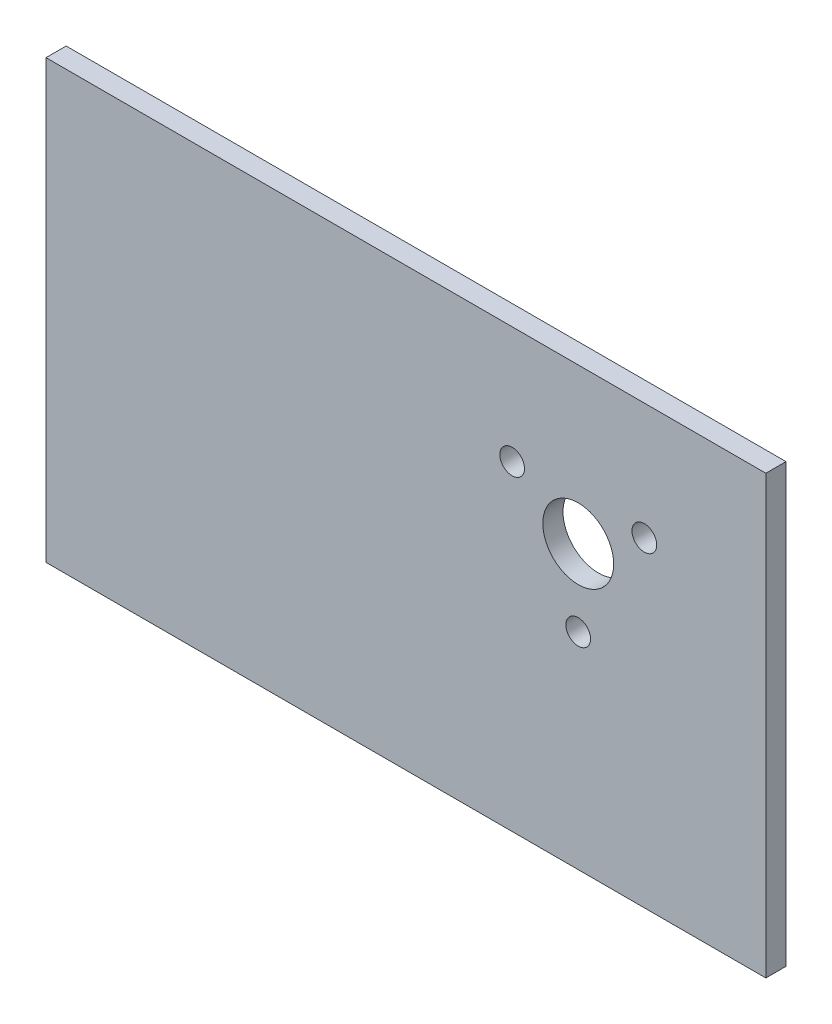
from build123d import *

# Parameters (mm, degrees)
SKETCH1_W           = 226.880047424
SKETCH1_H           = 137.780512054
SKETCH1_R           = 11.1633
SKETCH1_R_2         = 3.89255
BOSS_EXTRUDE1_DEPTH = 6.35


with BuildPart() as part:
    # Sketch1 → Boss-Extrude1 (new body)
    with BuildSketch(Plane.XY):
        with Locations((-14.939446487, 15.042256027)):
            Rectangle(SKETCH1_W, SKETCH1_H)
        with Locations((39.37, 35.1155)):
            Circle(SKETCH1_R, mode=Mode.SUBTRACT)
        with Locations((60.198, 47.140551407)):
            Circle(SKETCH1_R_2, mode=Mode.SUBTRACT)
        with Locations((39.37, 11.065397187)):
            Circle(SKETCH1_R_2, mode=Mode.SUBTRACT)
        with Locations((18.542, 47.140551407)):
            Circle(SKETCH1_R_2, mode=Mode.SUBTRACT)
    extrude(amount=BOSS_EXTRUDE1_DEPTH)


solid = part.part
